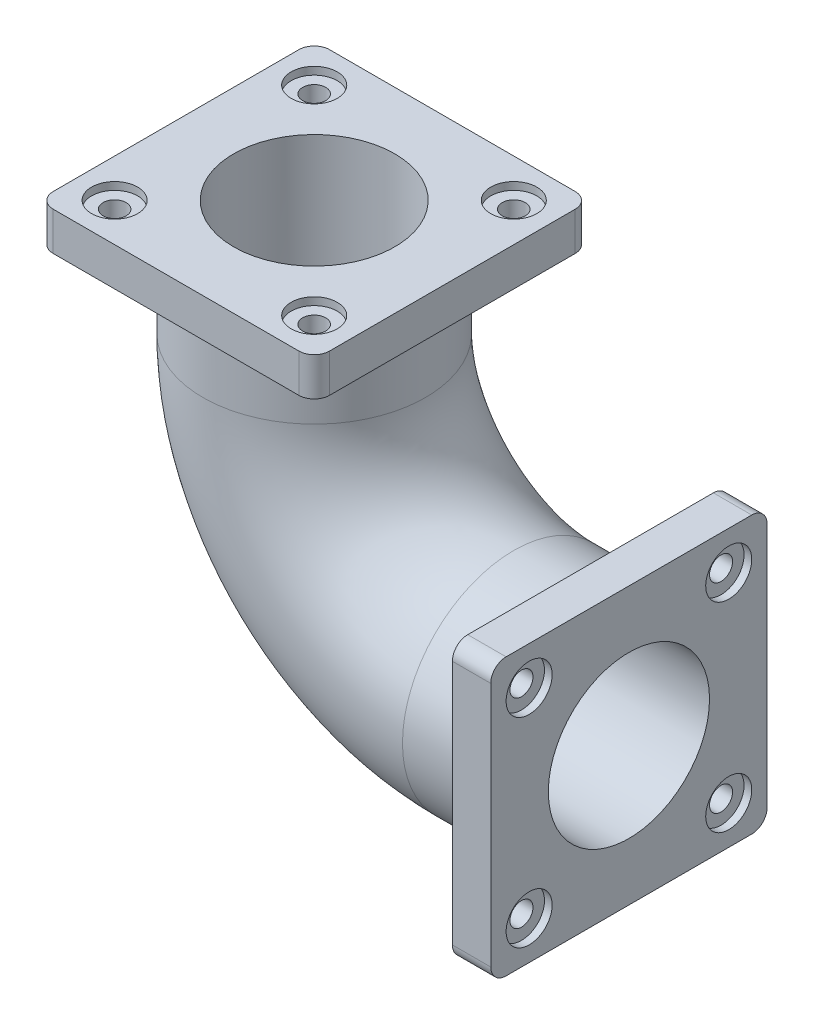
from build123d import *

# Parameters (mm, degrees)
SKETCH2_R           = 145
SKETCH2_R_2         = 105
BOSS_EXTRUDE1_START = -50
SKETCH3_W           = 360
SKETCH3_H           = 360
SKETCH3_R           = 145
BOSS_EXTRUDE1_DEPTH = 50
FILLET1_R           = 20
SKETCH4_R           = 145
BOSS_EXTRUDE2_DEPTH = 50
SKETCH5_R           = 30
CUT_EXTRUDE1_DEPTH  = 10
CUT_EXTRUDE2_REACH  = 742.675
SKETCH6_R           = 15
CIRPATTERN1_COUNT   = 4
SKETCH7_R           = 30
CUT_EXTRUDE3_DEPTH  = 10
CUT_EXTRUDE4_REACH  = 848.699
SKETCH8_R           = 15
CIRPATTERN2_COUNT   = 4


with BuildPart() as part:
    # Sweep-Thin1: sweep along a path in Sketch1
    with BuildLine(Plane.XY) as sweep_thin1_path:
        Line((0, 0), (-150, 0))
        ThreePointArc((-150, 0), (-333.847763109, 76.152236891), (-410, 260))
        Line((-410, 260), (-410, 410))
    # Sketch2 → Sweep-Thin1 (sweep)
    with BuildSketch(Plane(origin=(0, 0, 0), x_dir=(0, 0, -1), z_dir=(1, 0, 0))):
        Circle(SKETCH2_R)
        Circle(SKETCH2_R_2, mode=Mode.SUBTRACT)
    sweep(path=sweep_thin1_path.line)

    # Sketch3 → Boss-Extrude1 (add)
    with BuildSketch(Plane(origin=(0, 0, 0), x_dir=(0, 0, -1), z_dir=(1, 0, 0)).offset(BOSS_EXTRUDE1_START)):
        Rectangle(SKETCH3_W, SKETCH3_H)
        Circle(SKETCH3_R, mode=Mode.SUBTRACT)
    extrude(amount=BOSS_EXTRUDE1_DEPTH)

    # Fillet1
    fillet1_edges = [part.edges().sort_by_distance(p)[0] for p in [
        (-25, -180, 180),
        (-25, 180, 180),
        (-25, 180, -180),
        (-25, -180, -180),
    ]]
    fillet(fillet1_edges, radius=FILLET1_R)

    # Sketch4 → Boss-Extrude2 (add)
    with BuildSketch(Plane(origin=(0, 410, 0), x_dir=(1, 0, 0), z_dir=(0, 1, 0))):
        with BuildLine():
            ThreePointArc((-250, 180), (-235.857864376, 174.142135624), (-230, 160))
            Line((-230, 160), (-230, -160))
            ThreePointArc((-230, -160), (-235.857864376, -174.142135624), (-250, -180))
            Line((-250, -180), (-570, -180))
            ThreePointArc((-570, -180), (-584.142135624, -174.142135624), (-590, -160))
            Line((-590, -160), (-590, 160))
            ThreePointArc((-590, 160), (-584.142135624, 174.142135624), (-570, 180))
            Line((-570, 180), (-250, 180))
        make_face()
        with Locations(Location((-410, 0, 0), (0, 0, 180))):
            Circle(SKETCH4_R, mode=Mode.SUBTRACT)
    extrude(amount=-BOSS_EXTRUDE2_DEPTH)

    # Sketch5 → Cut-Extrude1 (cut)
    with BuildSketch(Plane(origin=(0, 0, 0), x_dir=(0, 0, -1), z_dir=(1, 0, 0))):
        with Locations((-130, 130)):
            Circle(SKETCH5_R)
    cut_extrude1 = extrude(amount=-CUT_EXTRUDE1_DEPTH, mode=Mode.SUBTRACT)

    # Sketch6 → Cut-Extrude2 (cut, up to next)
    with BuildSketch(Plane(origin=(0, 0, 0), x_dir=(0, 0, -1), z_dir=(1, 0, 0)), mode=Mode.PRIVATE) as cut_extrude2_sk1:
        with Locations((-130, 130)):
            Circle(SKETCH6_R)
    cut_extrude2_tool1 = extrude(cut_extrude2_sk1.sketch, amount=-CUT_EXTRUDE2_REACH, mode=Mode.PRIVATE) & part.part
    cut_extrude2 = cut_extrude2_tool1.solids().sort_by_distance((0, 130, 130))[0]
    add(cut_extrude2, mode=Mode.SUBTRACT)

    # CirPattern1: Cut-Extrude1, Cut-Extrude2 ×4 about axis
    cirpattern1_axis = Axis((0, 0, 0), (1, 0, 0))
    add([cut_extrude1.rotate(cirpattern1_axis, i * 360 / CIRPATTERN1_COUNT) for i in range(1, CIRPATTERN1_COUNT)], mode=Mode.SUBTRACT)
    add([cut_extrude2.rotate(cirpattern1_axis, i * 360 / CIRPATTERN1_COUNT) for i in range(1, CIRPATTERN1_COUNT)], mode=Mode.SUBTRACT)

    # Sketch7 → Cut-Extrude3 (cut)
    with BuildSketch(Plane(origin=(0, 410, 0), x_dir=(1, 0, 0), z_dir=(0, 1, 0))):
        with Locations(Location((-540, 130, 0), (0, 0, 270))):
            Circle(SKETCH7_R)
    cut_extrude3 = extrude(amount=-CUT_EXTRUDE3_DEPTH, mode=Mode.SUBTRACT)

    # Sketch8 → Cut-Extrude4 (cut, up to next)
    with BuildSketch(Plane(origin=(0, 400, 0), x_dir=(1, 0, 0), z_dir=(0, 1, 0)), mode=Mode.PRIVATE) as cut_extrude4_sk1:
        with Locations(Location((-540, 130, 0), (0, 0, 270))):
            Circle(SKETCH8_R)
    cut_extrude4_tool1 = extrude(cut_extrude4_sk1.sketch, amount=-CUT_EXTRUDE4_REACH, mode=Mode.PRIVATE) & part.part
    cut_extrude4 = cut_extrude4_tool1.solids().sort_by_distance((-540, 400, -130))[0]
    add(cut_extrude4, mode=Mode.SUBTRACT)

    # CirPattern2: Cut-Extrude3, Cut-Extrude4 ×4 about axis
    cirpattern2_axis = Axis((-410, 0, 0), (0, 1, 0))
    add([cut_extrude3.rotate(cirpattern2_axis, i * 360 / CIRPATTERN2_COUNT) for i in range(1, CIRPATTERN2_COUNT)], mode=Mode.SUBTRACT)
    add([cut_extrude4.rotate(cirpattern2_axis, i * 360 / CIRPATTERN2_COUNT) for i in range(1, CIRPATTERN2_COUNT)], mode=Mode.SUBTRACT)


solid = part.part
